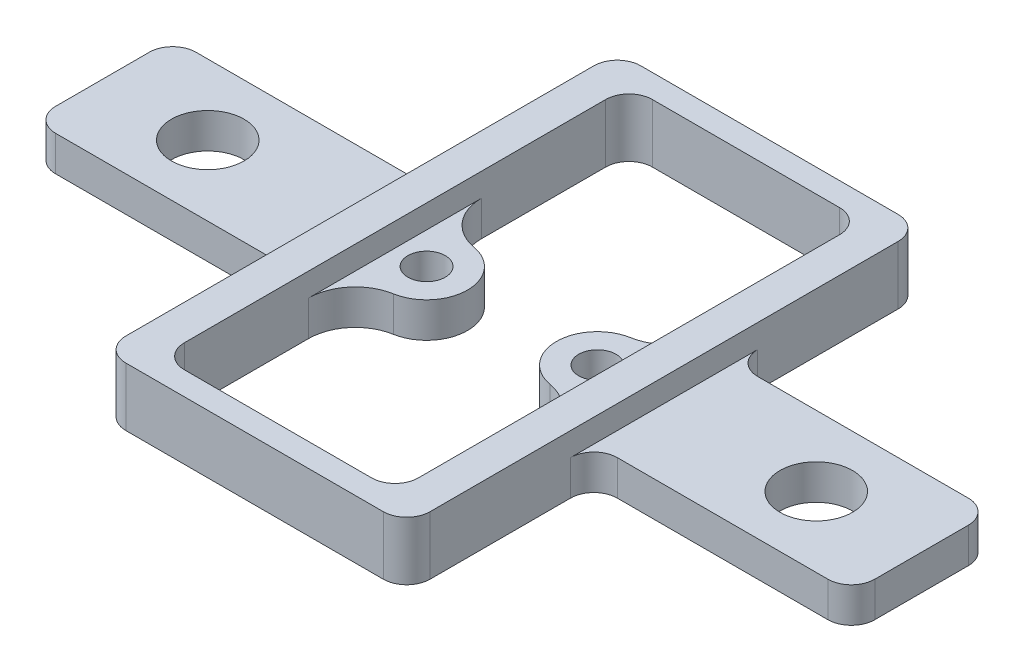
from build123d import *

# Parameters (mm, degrees)
SKETCH_1_W          = 11
SKETCH_1_H          = 6
SKETCH_1_W_2        = 13
SKETCH_1_H_2        = 8
EXTRUDE_1_DEPTH     = 1.5
CUT_EXTRUDE_1_DEPTH = 1.5
FILLET_1_R          = 2
FILLET_2_R          = 1
SKETCH_3_R          = 0.8
CUT_EXTRUDE_2_DEPTH = 10
EXTRUDE_2_DEPTH     = 1
SKETCH_5_R          = 1.55
CUT_EXTRUDE_3_DEPTH = 10


with BuildPart() as part:
    # 草图1 → 凸台-拉伸1 (new body)
    with BuildSketch(Plane(origin=(0, 0, 0), x_dir=(1, 0, 0), z_dir=(0, 1, 0))):
        with Locations((-12, 0)):
            Rectangle(SKETCH_1_W, SKETCH_1_H)
        with Locations((0, -7)):
            Rectangle(SKETCH_1_W_2, SKETCH_1_H_2)
        Rectangle(SKETCH_1_W_2, SKETCH_1_H)
        with Locations((0, 7)):
            Rectangle(SKETCH_1_W_2, SKETCH_1_H_2)
        with Locations((12, 0)):
            Rectangle(SKETCH_1_W, SKETCH_1_H)
    extrude(amount=EXTRUDE_1_DEPTH)

    # 草图2 → 切除-拉伸1 (cut)
    with BuildSketch(Plane(origin=(0, 1.5, 0), x_dir=(1, 0, 0), z_dir=(0, 1, 0))):
        with BuildLine():
            Line((-5, -10), (5, -10))
            Line((5, -10), (5, -1.113552873))
            ThreePointArc((5, -1.113552873), (1.9, 0), (5, 1.113552873))
            Line((5, 1.113552873), (5, 10))
            Line((5, 10), (-5, 10))
            Line((-5, 10), (-5, 1.113552873))
            ThreePointArc((-5, 1.113552873), (-1.9, 0), (-5, -1.113552873))
            Line((-5, -1.113552873), (-5, -10))
        make_face()
    extrude(amount=-CUT_EXTRUDE_1_DEPTH, mode=Mode.SUBTRACT)

    # 圆角1
    fillet_1_edges = [part.edges().sort_by_distance(p)[0] for p in [
        (5, 0.75, -1.113552873),
        (5, 0.75, 1.113552873),
        (-5, 0.75, 1.113552873),
        (-5, 0.75, -1.113552873),
    ]]
    fillet(fillet_1_edges, radius=FILLET_1_R)

    # 圆角2
    fillet_2_edges = [part.edges().sort_by_distance(p)[0] for p in [
        (-6.5, 0.75, -3),
        (-6.5, 0.75, -11),
        (6.5, 0.75, -11),
        (6.5, 0.75, -3),
        (17.5, 0.75, -3),
        (17.5, 0.75, 3),
        (6.5, 0.75, 3),
        (6.5, 0.75, 11),
        (-6.5, 0.75, 11),
        (-6.5, 0.75, 3),
        (-17.5, 0.75, 3),
        (-17.5, 0.75, -3),
        (5, 0.75, -10),
        (5, 0.75, 10),
        (-5, 0.75, 10),
        (-5, 0.75, -10),
    ]]
    fillet(fillet_2_edges, radius=FILLET_2_R)

    # 草图3 → 切除-拉伸2 (cut)
    with BuildSketch(Plane(origin=(0, 1.5, 0), x_dir=(1, 0, 0), z_dir=(0, 1, 0))):
        with Locations(Location((-3.65, 0, 0), (0, 0, 270))):
            Circle(SKETCH_3_R)
        with Locations(Location((3.65, 0, 0), (0, 0, 270))):
            Circle(SKETCH_3_R)
    extrude(amount=-CUT_EXTRUDE_2_DEPTH, mode=Mode.SUBTRACT)

    # 草图4 → 凸台-拉伸2 (add)
    with BuildSketch(Plane(origin=(0, 1.5, 0), x_dir=(1, 0, 0), z_dir=(0, 1, 0))):
        with BuildLine():
            Line((-6.5, -4), (-6.5, 4))
            Line((-6.5, 4), (-6.5, 10))
            ThreePointArc((-6.5, 10), (-6.207106781, 10.707106781), (-5.5, 11))
            Line((-5.5, 11), (5.5, 11))
            ThreePointArc((5.5, 11), (6.207106781, 10.707106781), (6.5, 10))
            Line((6.5, 10), (6.5, 4))
            Line((6.5, 4), (6.5, -4))
            Line((6.5, -4), (6.5, -10))
            ThreePointArc((6.5, -10), (6.207106781, -10.707106781), (5.5, -11))
            Line((5.5, -11), (-5.5, -11))
            ThreePointArc((-5.5, -11), (-6.207106781, -10.707106781), (-6.5, -10))
            Line((-6.5, -10), (-6.5, -4))
        make_face()
        with BuildLine():
            Line((5, -3.693237063), (5, 9))
            ThreePointArc((5, 9), (4.707106781, 9.707106781), (4, 10))
            Line((4, 10), (-4, 10))
            ThreePointArc((-4, 10), (-4.707106781, 9.707106781), (-5, 9))
            Line((-5, 9), (-5, -3.693237063))
            Line((-5, -3.693237063), (-5, -9))
            ThreePointArc((-5, -9), (-4.707106781, -9.707106781), (-4, -10))
            Line((-4, -10), (4, -10))
            ThreePointArc((4, -10), (4.707106781, -9.707106781), (5, -9))
            Line((5, -9), (5, -3.693237063))
        make_face(mode=Mode.SUBTRACT)
    extrude(amount=EXTRUDE_2_DEPTH)

    # 草图5 → 切除-拉伸3 (cut)
    with BuildSketch(Plane.XZ):
        with Locations(Location((-13, 0, 0), (0, 0, 270))):
            Circle(SKETCH_5_R)
        with Locations(Location((13, 0, 0), (0, 0, 90))):
            Circle(SKETCH_5_R)
    extrude(amount=-CUT_EXTRUDE_3_DEPTH, mode=Mode.SUBTRACT)


solid = part.part
